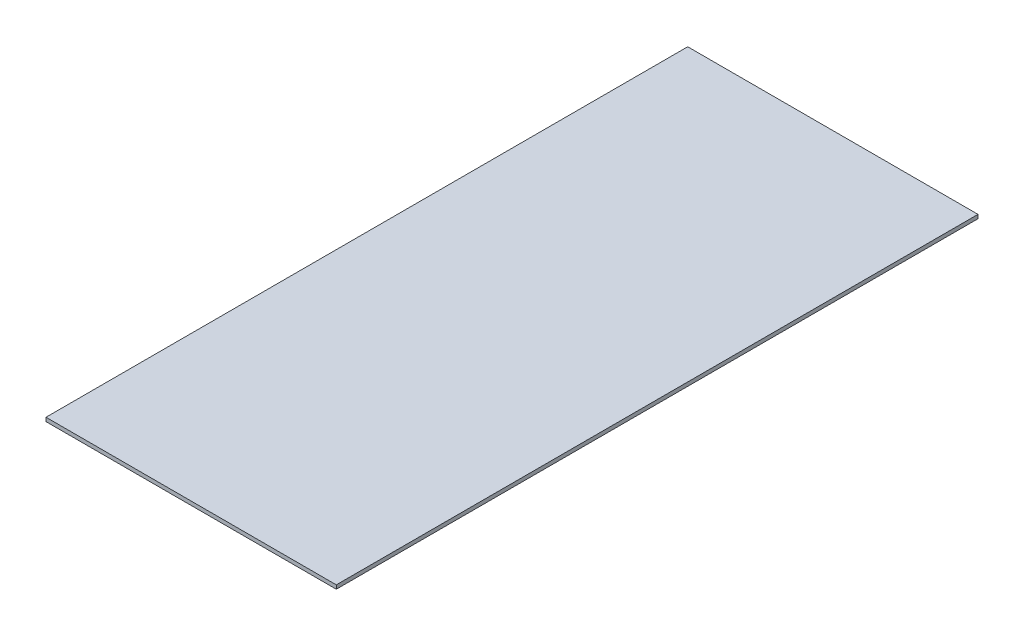
from build123d import *

# Parameters (mm, degrees)
SKETCH1_W           = 482.6
SKETCH1_H           = 6.35
BOSS_EXTRUDE1_DEPTH = 1066.8


with BuildPart() as part:
    # Sketch1 → Boss-Extrude1 (new body)
    with BuildSketch(Plane.XY):
        Rectangle(SKETCH1_W, SKETCH1_H)
    extrude(amount=BOSS_EXTRUDE1_DEPTH)


solid = part.part
